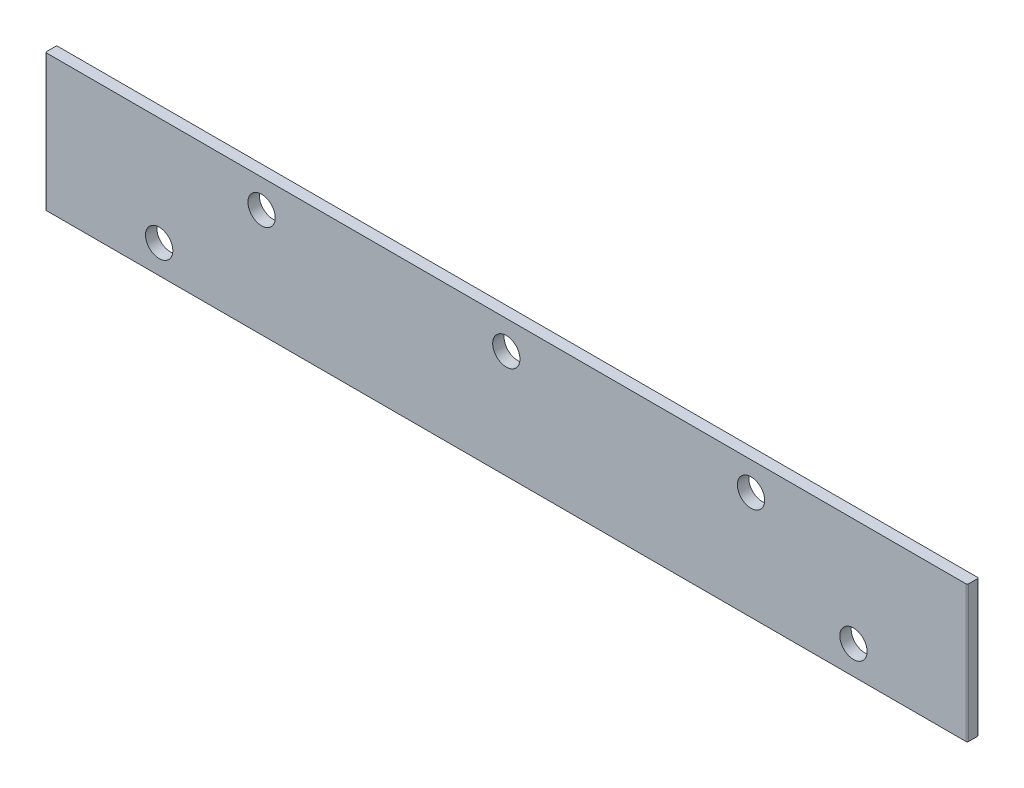
from build123d import *

# Parameters (mm, degrees)
SKETCH1_W           = 81
SKETCH1_H           = 12
BOSS_EXTRUDE1_DEPTH = 0.5
M2_HOLE1_AD_D       = 2.4
M2_HOLE1_AD_DEPTH   = 100
M2_HOLE1_AD_TIP     = 0.721032743
M2_HOLE2_AD_D       = 2.4
M2_HOLE2_AD_DEPTH   = 100
M2_HOLE2_AD_TIP     = 0.721032743
M2_HOLE3_AE_D       = 2.4
M2_HOLE3_AE_DEPTH   = 200
M2_HOLE3_AE_TIP     = 0.721032743
FILLET1_R           = 0.1


with BuildPart() as part:
    # Sketch1 → Boss-Extrude1 (new, symmetric)
    with BuildSketch(Plane.XY):
        Rectangle(SKETCH1_W, SKETCH1_H)
    extrude(amount=BOSS_EXTRUDE1_DEPTH, both=True)

    # M2 Hole1 - AD
    with Locations(Plane.XY.offset(0.5)):
        with Locations((-30.5, -3.5), (30.5, -3.5)):
            Hole(M2_HOLE1_AD_D / 2, depth=M2_HOLE1_AD_DEPTH)
            with Locations((0, 0, -(M2_HOLE1_AD_DEPTH + M2_HOLE1_AD_TIP / 2))):  # 118° drill point
                Cone(0, M2_HOLE1_AD_D / 2, M2_HOLE1_AD_TIP, mode=Mode.SUBTRACT)

    # M2 Hole2 - AD
    with Locations(Plane.XY.offset(0.5)):
        with Locations((-21.5, 3.5), (21.5, 3.5)):
            Hole(M2_HOLE2_AD_D / 2, depth=M2_HOLE2_AD_DEPTH)
            with Locations((0, 0, -(M2_HOLE2_AD_DEPTH + M2_HOLE2_AD_TIP / 2))):  # 118° drill point
                Cone(0, M2_HOLE2_AD_D / 2, M2_HOLE2_AD_TIP, mode=Mode.SUBTRACT)

    # M2 Hole3 - AE
    with Locations(Plane.XY.offset(0.5)):
        with Locations((0, 3.5)):
            Hole(M2_HOLE3_AE_D / 2, depth=M2_HOLE3_AE_DEPTH)
            with Locations((0, 0, -(M2_HOLE3_AE_DEPTH + M2_HOLE3_AE_TIP / 2))):  # 118° drill point
                Cone(0, M2_HOLE3_AE_D / 2, M2_HOLE3_AE_TIP, mode=Mode.SUBTRACT)

    # Fillet1
    fillet1_edges = [part.edges().sort_by_distance(p)[0] for p in [
        (-40.5, 0, 0.5),
        (40.5, 0, 0.5),
        (-40.5, 0, -0.5),
        (40.5, 0, -0.5),
    ]]
    fillet(fillet1_edges, radius=FILLET1_R)


solid = part.part
